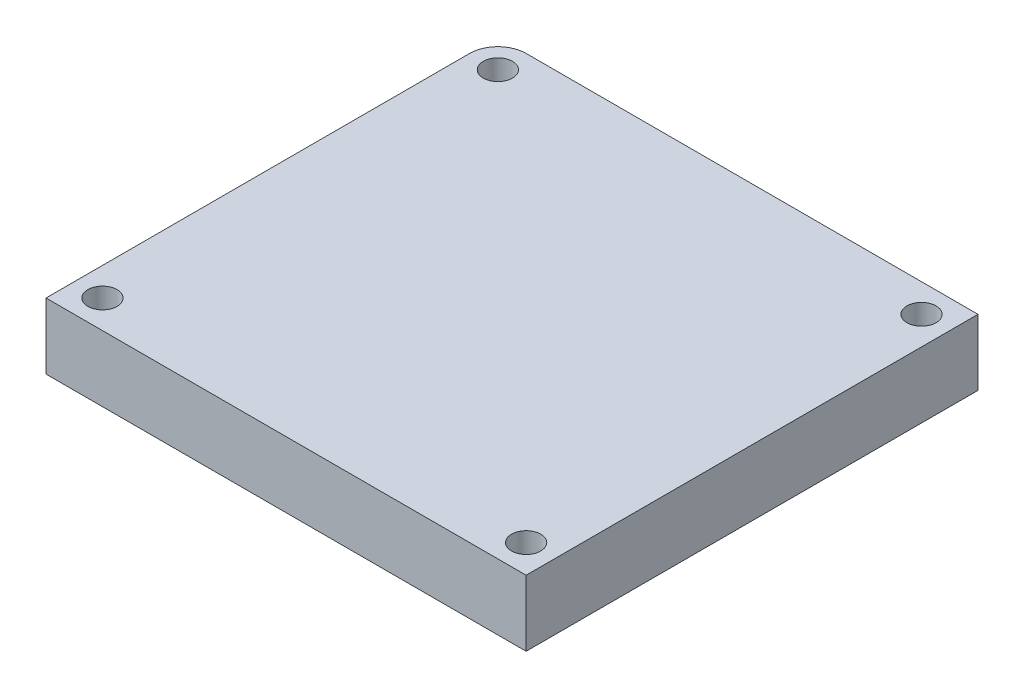
from build123d import *

# Parameters (mm, degrees)
SKETCH1_R           = 1.55
BOSS_EXTRUDE1_DEPTH = 7


with BuildPart() as part:
    # Sketch1 → Boss-Extrude1 (new body)
    with BuildSketch(Plane(origin=(0, 0, 0), x_dir=(1, 0, 0), z_dir=(0, 1, 0))):
        with BuildLine():
            Line((-94.441213517, -25.59472558), (-43.441213517, -25.59472558))
            Line((-43.441213517, -25.59472558), (-43.441213517, 22.40527442))
            Line((-43.441213517, 22.40527442), (-91.441213517, 22.40527442))
            ThreePointArc((-91.441213517, 22.40527442), (-93.562533861, 21.526594764), (-94.441213517, 19.40527442))
            Line((-94.441213517, 19.40527442), (-94.441213517, -25.59472558))
        make_face()
        with Locations(Location((-46.441213517, 19.40527442, 0), (0, 0, 270))):
            Circle(SKETCH1_R, mode=Mode.SUBTRACT)
        with Locations(Location((-46.441213517, -22.59472558, 0), (0, 0, 270))):
            Circle(SKETCH1_R, mode=Mode.SUBTRACT)
        with Locations(Location((-91.441213517, -22.59472558, 0), (0, 0, 270))):
            Circle(SKETCH1_R, mode=Mode.SUBTRACT)
        with Locations(Location((-91.441213517, 19.40527442, 0), (0, 0, 270))):
            Circle(SKETCH1_R, mode=Mode.SUBTRACT)
    extrude(amount=BOSS_EXTRUDE1_DEPTH)


solid = part.part
